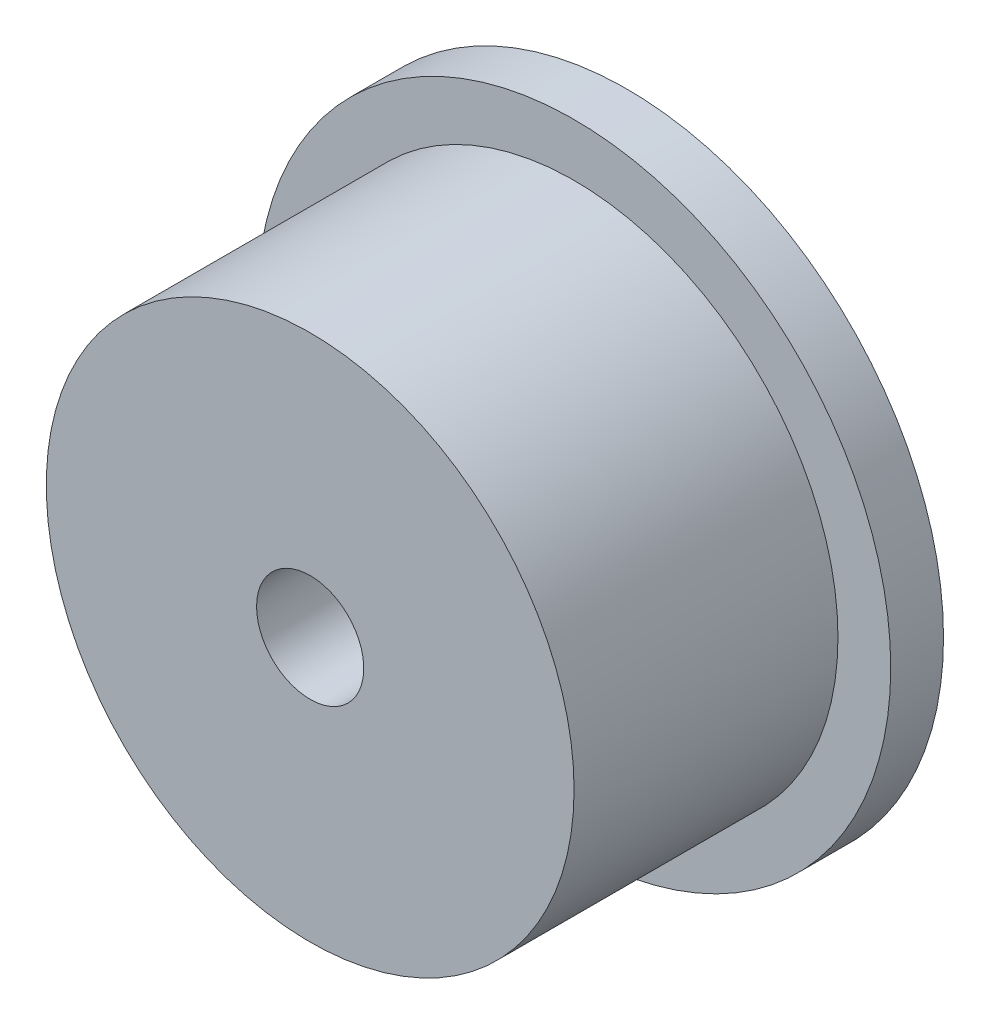
from build123d import *

# Parameters (mm, degrees)
SKETCH2_R          = 2.5796875
CUT_EXTRUDE1_DEPTH = 27.396454307
SKETCH3_R          = 4.7625
CUT_EXTRUDE2_DEPTH = 1.4732


with BuildPart() as part:
    # Sketch1 → Revolve1 (revolve)
    with BuildSketch(Plane(origin=(0, 0, 0), x_dir=(1, 0, 0), z_dir=(0, 1, 0)), mode=Mode.PRIVATE) as revolve1_sk:
        Polygon((0, 71.120493703), (0, 86.360493703), (-15.24, 86.360493703), (-15.24, 83.820493703), (-12.7, 83.820493703), (-12.7, 71.120493703), align=None)
    revolve(revolve1_sk.sketch.rotate(Axis((0, 0, 0), (0, 0, -1)), 180), axis=Axis((0, 0, 0), (0, 0, -1)))

    # Sketch2 → Cut-Extrude1 (cut, through all)
    with BuildSketch(Plane(origin=(0, 0, -86.360493703), x_dir=(-1, 0, 0), z_dir=(0, 0, -1))):
        Circle(SKETCH2_R)
    extrude(amount=-CUT_EXTRUDE1_DEPTH, mode=Mode.SUBTRACT)

    # Sketch3 → Cut-Extrude2 (cut)
    with BuildSketch(Plane(origin=(0, 0, -86.360493703), x_dir=(-1, 0, 0), z_dir=(0, 0, -1))):
        Circle(SKETCH3_R)
    extrude(amount=-CUT_EXTRUDE2_DEPTH, mode=Mode.SUBTRACT)


solid = part.part
